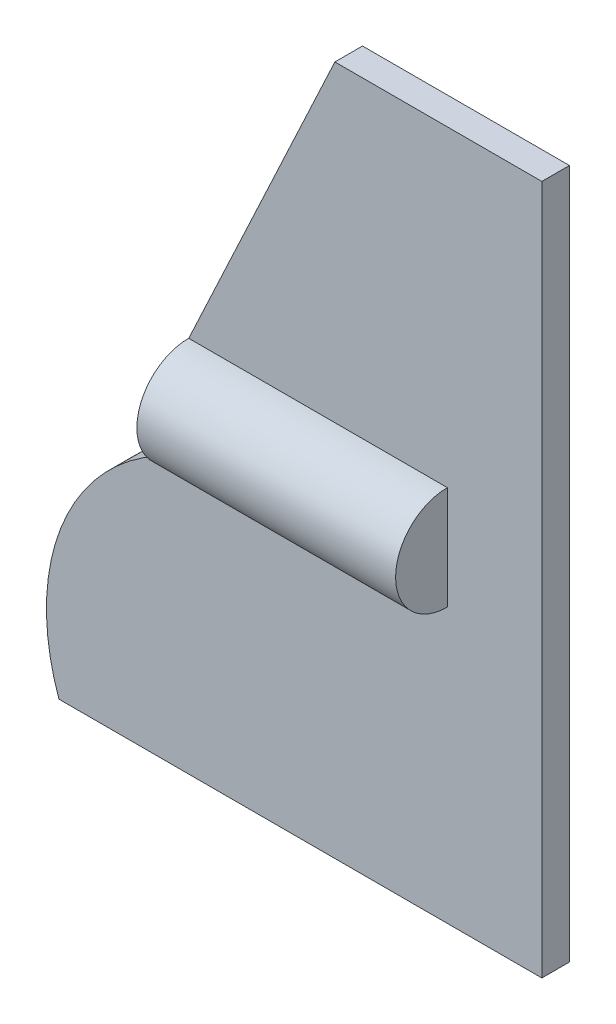
from build123d import *

# Parameters (mm, degrees)
BOSS_EXTRUDE1_DEPTH = 4
BOSS_EXTRUDE2_DEPTH = 37.5
SKETCH7_R           = 5
CUT_EXTRUDE1_DEPTH  = 30


with BuildPart() as part:
    # Sketch1 → Boss-Extrude1 (new body)
    with BuildSketch(Plane.XY):
        with BuildLine():
            Line((0, 0), (70, 0))
            Line((70, 0), (70, 100))
            Line((70, 100), (40, 100))
            Line((40, 100), (18.812777554, 54.710910751))
            Line((18.812777554, 54.710910751), (18.812777554, 39.710910751))
            ThreePointArc((18.812777554, 39.710910751), (1.181989874, 23.75170918), (0, 0))
        make_face()
    extrude(amount=BOSS_EXTRUDE1_DEPTH)

    # Sketch5 → Boss-Extrude2 (add)
    with BuildSketch(Plane(origin=(18.8, 0, 0), x_dir=(0, 0, -1), z_dir=(1, 0, 0))):
        with BuildLine():
            Line((-4, 54.710910751), (-4, 39.710910751))
            ThreePointArc((-4, 39.710910751), (-11.5, 47.210910751), (-4, 54.710910751))
        make_face()
    extrude(amount=BOSS_EXTRUDE2_DEPTH)

    # Sketch7 → Cut-Extrude1 (cut)
    with BuildSketch(Plane(origin=(18.8, 0, 0), x_dir=(0, 0, -1), z_dir=(1, 0, 0))):
        with Locations(Location((-5.690630422, 47.210910751, 0), (0, 0, 289.762746065))):
            Circle(SKETCH7_R)
    extrude(amount=CUT_EXTRUDE1_DEPTH, mode=Mode.SUBTRACT)


solid = part.part
